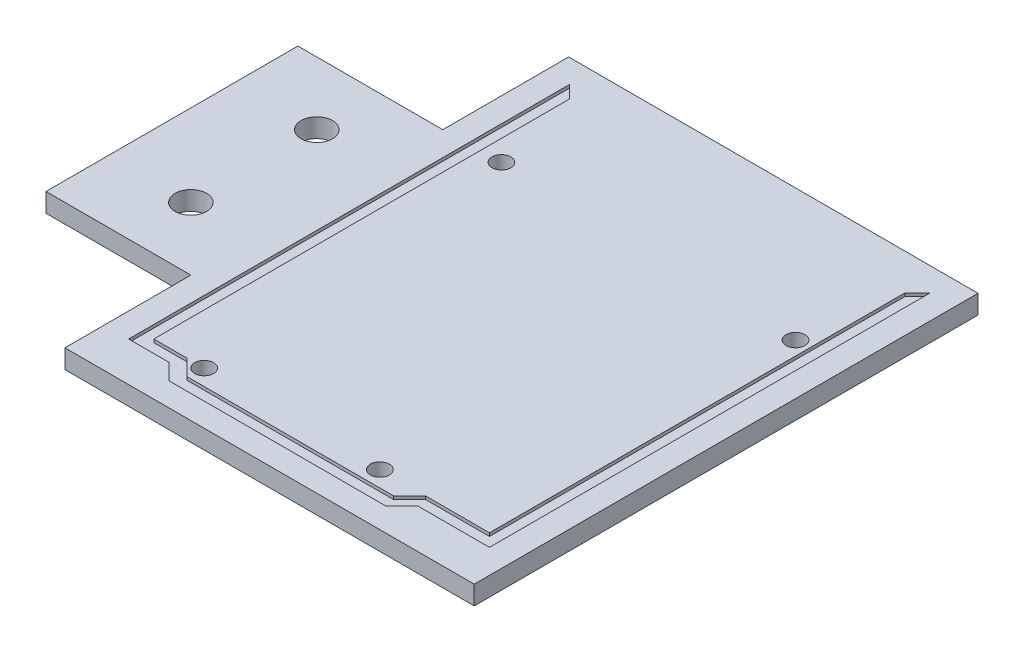
from build123d import *

# Parameters (mm, degrees)
BOSS_EXTRUDE1_DEPTH = 40
CUT_EXTRUDE1_REACH  = 53.556
SKETCH2_R           = 2.5
CUT_EXTRUDE2_REACH  = 53.556
SKETCH3_R           = 2.5
FILLET1_R           = 5
SKETCH4_W           = 65
SKETCH4_H           = 80
BOSS_EXTRUDE2_DEPTH = 3
CUT_EXTRUDE3_DEPTH  = 0.5
CUT_EXTRUDE4_REACH  = 110.963
SKETCH6_R           = 1.5
CUT_EXTRUDE5_REACH  = 110.963
SKETCH7_W           = 40
SKETCH7_H           = 20


with BuildPart() as part:
    # Sketch1 → Boss-Extrude1 (new body)
    with BuildSketch(Plane.XY):
        Polygon((0, 0), (0, 23), (23, 23), (23, 20), (3, 20), (3, 0), align=None)
    extrude(amount=BOSS_EXTRUDE1_DEPTH)

    # Sketch2 → Cut-Extrude1 (cut, up to next)
    with BuildSketch(Plane(origin=(0, 23, 0), x_dir=(1, 0, 0), z_dir=(0, 1, 0)), mode=Mode.PRIVATE) as cut_extrude1_sk1:
        with Locations(Location((13, -10, 0), (0, 0, 270))):
            Circle(SKETCH2_R)
    cut_extrude1_tool1 = extrude(cut_extrude1_sk1.sketch, amount=-CUT_EXTRUDE1_REACH, mode=Mode.PRIVATE) & part.part
    # Sketch2 → Cut-Extrude1 (cut, up to next)
    with BuildSketch(Plane(origin=(0, 23, 0), x_dir=(1, 0, 0), z_dir=(0, 1, 0)), mode=Mode.PRIVATE) as cut_extrude1_sk2:
        with Locations(Location((13, -30, 0), (0, 0, 270))):
            Circle(SKETCH2_R)
    cut_extrude1_tool2 = extrude(cut_extrude1_sk2.sketch, amount=-CUT_EXTRUDE1_REACH, mode=Mode.PRIVATE) & part.part
    add(cut_extrude1_tool1.solids().sort_by_distance((13, 23, 10))[0], mode=Mode.SUBTRACT)
    add(cut_extrude1_tool2.solids().sort_by_distance((13, 23, 30))[0], mode=Mode.SUBTRACT)

    # Sketch3 → Cut-Extrude2 (cut, up to next)
    with BuildSketch(Plane.ZY, mode=Mode.PRIVATE) as cut_extrude2_sk1:
        with Locations((10, 10)):
            Circle(SKETCH3_R)
    cut_extrude2_tool1 = extrude(cut_extrude2_sk1.sketch, amount=-CUT_EXTRUDE2_REACH, mode=Mode.PRIVATE) & part.part
    # Sketch3 → Cut-Extrude2 (cut, up to next)
    with BuildSketch(Plane.ZY, mode=Mode.PRIVATE) as cut_extrude2_sk2:
        with Locations((30, 10)):
            Circle(SKETCH3_R)
    cut_extrude2_tool2 = extrude(cut_extrude2_sk2.sketch, amount=-CUT_EXTRUDE2_REACH, mode=Mode.PRIVATE) & part.part
    add(cut_extrude2_tool1.solids().sort_by_distance((0, 10, 10))[0], mode=Mode.SUBTRACT)
    add(cut_extrude2_tool2.solids().sort_by_distance((0, 10, 30))[0], mode=Mode.SUBTRACT)

    # Fillet1
    fillet1_edges = [part.edges().sort_by_distance(p)[0] for p in [
        (1.5, 0, 40),
        (1.5, 0, 0),
    ]]
    fillet(fillet1_edges, radius=FILLET1_R)

    # Sketch4 → Boss-Extrude2 (add)
    with BuildSketch(Plane(origin=(0, 23, 0), x_dir=(1, 0, 0), z_dir=(0, 1, 0))):
        with Locations((55.5, -20)):
            Rectangle(SKETCH4_W, SKETCH4_H)
    extrude(amount=-BOSS_EXTRUDE2_DEPTH)

    # Sketch5 → Cut-Extrude3 (cut)
    with BuildSketch(Plane(origin=(0, 23, 0), x_dir=(1, 0, 0), z_dir=(0, 1, 0))):
        Polygon((28.85, 14.27), (28.85, -51.73), (34.11, -51.73), (36.65, -54.27), (69.45, -54.27), (71.99, -51.73), (82.15, -51.73), (82.15, 14.27), (84.15, 16.27), (84.15, -53.73), (72.818427125, -53.73), (70.278427125, -56.27), (35.821572875, -56.27), (33.281572875, -53.73), (26.85, -53.73), (26.85, 16.27), align=None)
    extrude(amount=-CUT_EXTRUDE3_DEPTH, mode=Mode.SUBTRACT)

    # Sketch6 → Cut-Extrude4 (cut, up to next)
    with BuildSketch(Plane(origin=(0, 23, 0), x_dir=(1, 0, 0), z_dir=(0, 1, 0)), mode=Mode.PRIVATE) as cut_extrude4_sk1:
        with Locations(Location((32.15, 0.17, 0), (0, 0, 270))):
            Circle(SKETCH6_R)
    cut_extrude4_tool1 = extrude(cut_extrude4_sk1.sketch, amount=-CUT_EXTRUDE4_REACH, mode=Mode.PRIVATE) & part.part
    # Sketch6 → Cut-Extrude4 (cut, up to next)
    with BuildSketch(Plane(origin=(0, 23, 0), x_dir=(1, 0, 0), z_dir=(0, 1, 0)), mode=Mode.PRIVATE) as cut_extrude4_sk2:
        with Locations(Location((79.95, -0.93, 0), (0, 0, 270))):
            Circle(SKETCH6_R)
    cut_extrude4_tool2 = extrude(cut_extrude4_sk2.sketch, amount=-CUT_EXTRUDE4_REACH, mode=Mode.PRIVATE) & part.part
    # Sketch6 → Cut-Extrude4 (cut, up to next)
    with BuildSketch(Plane(origin=(0, 23, 0), x_dir=(1, 0, 0), z_dir=(0, 1, 0)), mode=Mode.PRIVATE) as cut_extrude4_sk3:
        with Locations(Location((64.75, -51.73, 0), (0, 0, 270))):
            Circle(SKETCH6_R)
    cut_extrude4_tool3 = extrude(cut_extrude4_sk3.sketch, amount=-CUT_EXTRUDE4_REACH, mode=Mode.PRIVATE) & part.part
    # Sketch6 → Cut-Extrude4 (cut, up to next)
    with BuildSketch(Plane(origin=(0, 23, 0), x_dir=(1, 0, 0), z_dir=(0, 1, 0)), mode=Mode.PRIVATE) as cut_extrude4_sk4:
        with Locations(Location((36.85, -51.73, 0), (0, 0, 270))):
            Circle(SKETCH6_R)
    cut_extrude4_tool4 = extrude(cut_extrude4_sk4.sketch, amount=-CUT_EXTRUDE4_REACH, mode=Mode.PRIVATE) & part.part
    add(cut_extrude4_tool1.solids().sort_by_distance((32.15, 23, -0.17))[0], mode=Mode.SUBTRACT)
    add(cut_extrude4_tool2.solids().sort_by_distance((79.95, 23, 0.93))[0], mode=Mode.SUBTRACT)
    add(cut_extrude4_tool3.solids().sort_by_distance((64.75, 23, 51.73))[0], mode=Mode.SUBTRACT)
    add(cut_extrude4_tool4.solids().sort_by_distance((36.85, 23, 51.73))[0], mode=Mode.SUBTRACT)

    # Sketch7 → Cut-Extrude5 (cut, up to next)
    with BuildSketch(Plane.ZY, mode=Mode.PRIVATE) as cut_extrude5_sk1:
        with Locations((20, 10)):
            Rectangle(SKETCH7_W, SKETCH7_H)
    cut_extrude5_tool1 = extrude(cut_extrude5_sk1.sketch, amount=-CUT_EXTRUDE5_REACH, mode=Mode.PRIVATE) & part.part
    add(cut_extrude5_tool1.solids().sort_by_distance((0, 10, 20))[0], mode=Mode.SUBTRACT)


solid = part.part
